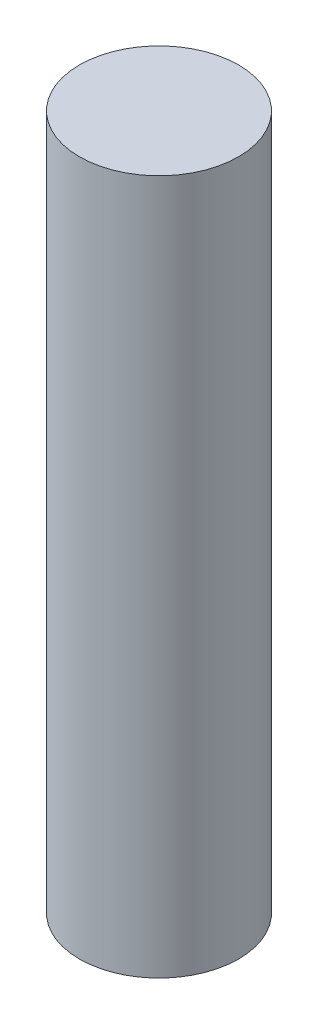
from build123d import *

# Parameters (mm, degrees)
SKETCH1_R           = 75
BOSS_EXTRUDE1_DEPTH = 655


with BuildPart() as part:
    # Sketch1 → Boss-Extrude1 (new body)
    with BuildSketch(Plane(origin=(0, 0, 0), x_dir=(1, 0, 0), z_dir=(0, 1, 0))):
        with Locations(Location((0, 0, 0), (0, 0, 270))):
            Circle(SKETCH1_R)
    extrude(amount=BOSS_EXTRUDE1_DEPTH)


solid = part.part
